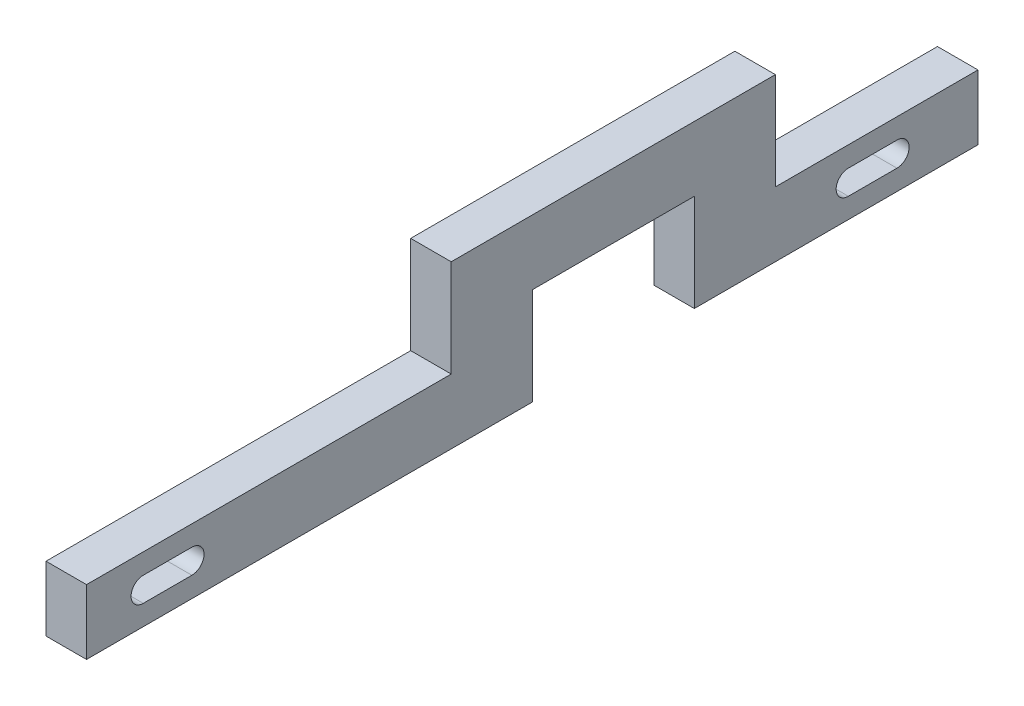
from build123d import *

# Parameters (mm, degrees)
EXTRUDE_1_DEPTH = 5


with BuildPart() as part:
    # 草图1 → 凸台-拉伸1 (new body)
    with BuildSketch(Plane(origin=(0, 0, 0), x_dir=(0, 0, -1), z_dir=(1, 0, 0))):
        Polygon((-30.407718659, 7.81238306), (14.592281341, 7.81238306), (14.592281341, 19.81238306), (54.592281341, 19.81238306), (54.592281341, 7.81238306), (79.592281341, 7.81238306), (79.592281341, -0.18761694), (44.592281341, -0.18761694), (44.592281341, 7.81238306), (44.592281341, 11.81238306), (24.592281341, 11.81238306), (24.592281341, 3.81238306), (24.592281341, -0.18761694), (-30.407718659, -0.18761694), align=None)
        with BuildLine():
            Line((-23.407718659, 5.31238306), (-17.407718659, 5.31238306))
            ThreePointArc((-17.407718659, 5.31238306), (-15.907718659, 3.81238306), (-17.407718659, 2.31238306))
            Line((-17.407718659, 2.31238306), (-23.407718659, 2.31238306))
            ThreePointArc((-23.407718659, 2.31238306), (-24.907718659, 3.81238306), (-23.407718659, 5.31238306))
        make_face(mode=Mode.SUBTRACT)
        with BuildLine():
            Line((69.592281341, 2.31238306), (63.592281341, 2.31238306))
            ThreePointArc((63.592281341, 2.31238306), (62.092281341, 3.81238306), (63.592281341, 5.31238306))
            Line((63.592281341, 5.31238306), (69.592281341, 5.31238306))
            ThreePointArc((69.592281341, 5.31238306), (71.092281341, 3.81238306), (69.592281341, 2.31238306))
        make_face(mode=Mode.SUBTRACT)
    extrude(amount=EXTRUDE_1_DEPTH)


solid = part.part
